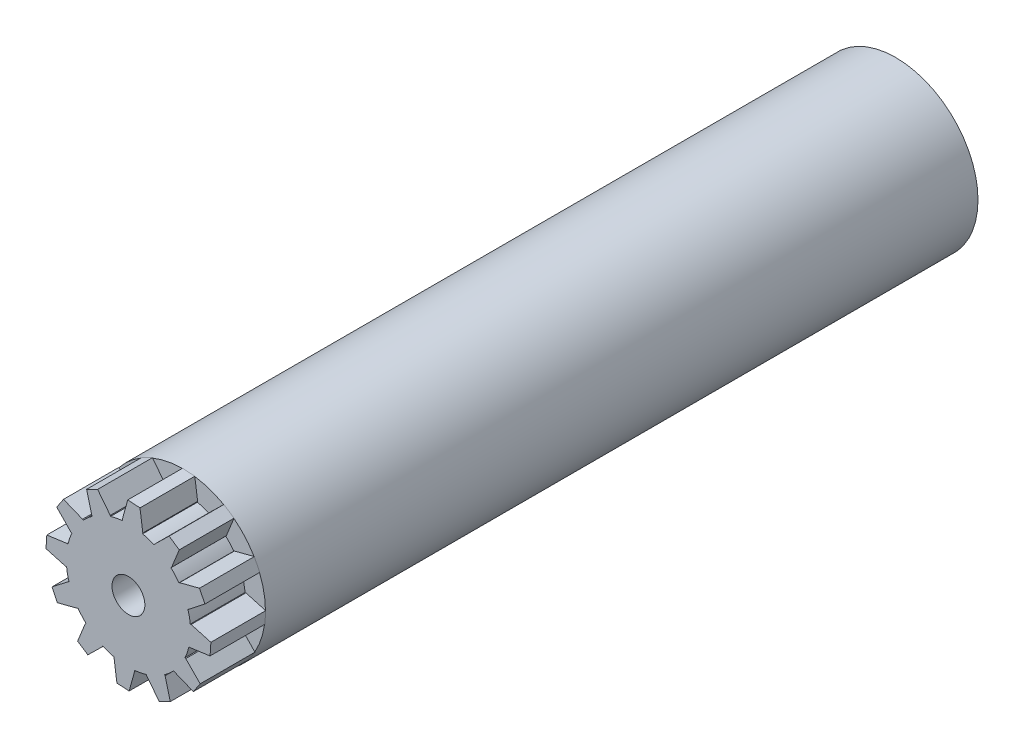
from build123d import *

# Parameters (mm, degrees)
SKETCH1_R           = 7.5
BOSS_EXTRUDE1_DEPTH = 65
BOSS_EXTRUDE7_DEPTH = 5
SKETCH5_R           = 1.5
CUT_EXTRUDE1_DEPTH  = 71.803359707


with BuildPart() as part:
    # Sketch1 → Boss-Extrude1 (new body)
    with BuildSketch(Plane.XY):
        Circle(SKETCH1_R)
    extrude(amount=BOSS_EXTRUDE1_DEPTH)

    # Sketch4 → Boss-Extrude7 (add)
    with BuildSketch(Plane.XY.offset(65)):
        with BuildLine():
            Line((1.29482372, 5.515672238), (1.312530063, 5.591097474))
            Line((1.312530063, 5.591097474), (1.052683226, 7.446710482))
            Line((1.052683226, 7.446710482), (-0.061368597, 7.52049685))
            Line((-0.061368597, 7.52049685), (-0.563675613, 5.715363149))
            Line((-0.563675613, 5.715363149), (-0.556071495, 5.63826154))
            ThreePointArc((-0.556071495, 5.63826154), (0.374427225, 5.653230311), (1.29482372, 5.515672238))
        make_face()
        with BuildLine():
            ThreePointArc((2.337558729, 5.160913474), (1.824832598, 5.363692263), (1.29482372, 5.515672238))
            Line((1.29482372, 5.515672238), (0, 0))
            Line((0, 0), (2.337558729, 5.160913474))
        make_face()
        with BuildLine():
            Line((0, 0), (1.29482372, 5.515672238))
            ThreePointArc((1.29482372, 5.515672238), (0.374427225, 5.653230311), (-0.556071495, 5.63826154))
            Line((-0.556071495, 5.63826154), (0, 0))
        make_face()
        with BuildLine():
            Line((-1.636485884, 5.424124137), (0, 0))
            Line((0, 0), (-0.556071495, 5.63826154))
            ThreePointArc((-0.556071495, 5.63826154), (-1.101494744, 5.557510057), (-1.636485884, 5.424124137))
        make_face()
        with BuildLine():
            Line((2.337558729, 5.160913474), (0, 0))
            Line((0, 0), (3.879186354, 4.129300417))
            ThreePointArc((3.879186354, 4.129300417), (3.150878645, 4.708627451), (2.337558729, 5.160913474))
        make_face()
        with BuildLine():
            Line((4.604841979, 3.300702811), (0, 0))
            Line((0, 0), (5.424124137, 1.636485884))
            ThreePointArc((5.424124137, 1.636485884), (5.083054676, 2.502351667), (4.604841979, 3.300702811))
        make_face()
        with BuildLine():
            Line((3.879186354, 4.129300417), (0, 0))
            Line((0, 0), (4.604841979, 3.300702811))
            ThreePointArc((4.604841979, 3.300702811), (4.262197519, 3.732677459), (3.879186354, 4.129300417))
        make_face()
        with BuildLine():
            Line((5.63826154, 0.556071495), (0, 0))
            Line((0, 0), (5.515672238, -1.29482372))
            ThreePointArc((5.515672238, -1.29482372), (5.628005488, -0.651738388), (5.665616357, 0))
            ThreePointArc((5.665616357, 0), (5.65877352, 0.27837196), (5.63826154, 0.556071495))
        make_face()
        with BuildLine():
            Line((5.424124137, 1.636485884), (0, 0))
            Line((0, 0), (5.63826154, 0.556071495))
            ThreePointArc((5.63826154, 0.556071495), (5.557510057, 1.101494744), (5.424124137, 1.636485884))
        make_face()
        with BuildLine():
            Line((5.160913474, -2.337558729), (0, 0))
            Line((0, 0), (4.129300417, -3.879186354))
            ThreePointArc((4.129300417, -3.879186354), (4.708627451, -3.150878645), (5.160913474, -2.337558729))
        make_face()
        with BuildLine():
            Line((5.515672238, -1.29482372), (0, 0))
            Line((0, 0), (5.160913474, -2.337558729))
            ThreePointArc((5.160913474, -2.337558729), (5.363692263, -1.824832598), (5.515672238, -1.29482372))
        make_face()
        with BuildLine():
            Line((3.300702811, -4.604841979), (0, 0))
            Line((0, 0), (1.636485884, -5.424124137))
            ThreePointArc((1.636485884, -5.424124137), (2.502351667, -5.083054676), (3.300702811, -4.604841979))
        make_face()
        with BuildLine():
            Line((4.129300417, -3.879186354), (0, 0))
            Line((0, 0), (3.300702811, -4.604841979))
            ThreePointArc((3.300702811, -4.604841979), (3.732677459, -4.262197519), (4.129300417, -3.879186354))
        make_face()
        with BuildLine():
            Line((0.556071495, -5.63826154), (0, 0))
            Line((0, 0), (-1.29482372, -5.515672238))
            ThreePointArc((-1.29482372, -5.515672238), (-0.374427225, -5.653230311), (0.556071495, -5.63826154))
        make_face()
        with BuildLine():
            Line((1.636485884, -5.424124137), (0, 0))
            Line((0, 0), (0.556071495, -5.63826154))
            ThreePointArc((0.556071495, -5.63826154), (1.101494744, -5.557510057), (1.636485884, -5.424124137))
        make_face()
        with BuildLine():
            Line((-2.337558729, -5.160913474), (0, 0))
            Line((0, 0), (-3.879186354, -4.129300417))
            ThreePointArc((-3.879186354, -4.129300417), (-3.150878645, -4.708627451), (-2.337558729, -5.160913474))
        make_face()
        with BuildLine():
            Line((-1.29482372, -5.515672238), (0, 0))
            Line((0, 0), (-2.337558729, -5.160913474))
            ThreePointArc((-2.337558729, -5.160913474), (-1.824832598, -5.363692263), (-1.29482372, -5.515672238))
        make_face()
        with BuildLine():
            Line((-4.604841979, -3.300702811), (0, 0))
            Line((0, 0), (-5.424124137, -1.636485884))
            ThreePointArc((-5.424124137, -1.636485884), (-5.083054676, -2.502351667), (-4.604841979, -3.300702811))
        make_face()
        with BuildLine():
            Line((-3.879186354, -4.129300417), (0, 0))
            Line((0, 0), (-4.604841979, -3.300702811))
            ThreePointArc((-4.604841979, -3.300702811), (-4.262197519, -3.732677459), (-3.879186354, -4.129300417))
        make_face()
        with BuildLine():
            Line((-5.63826154, -0.556071495), (0, 0))
            Line((0, 0), (-5.515672238, 1.29482372))
            ThreePointArc((-5.515672238, 1.29482372), (-5.653230311, 0.374427225), (-5.63826154, -0.556071495))
        make_face()
        with BuildLine():
            Line((-5.424124137, -1.636485884), (0, 0))
            Line((0, 0), (-5.63826154, -0.556071495))
            ThreePointArc((-5.63826154, -0.556071495), (-5.557510057, -1.101494744), (-5.424124137, -1.636485884))
        make_face()
        with BuildLine():
            Line((-5.160913474, 2.337558729), (0, 0))
            Line((0, 0), (-4.129300417, 3.879186354))
            ThreePointArc((-4.129300417, 3.879186354), (-4.708627451, 3.150878645), (-5.160913474, 2.337558729))
        make_face()
        with BuildLine():
            Line((-5.515672238, 1.29482372), (0, 0))
            Line((0, 0), (-5.160913474, 2.337558729))
            ThreePointArc((-5.160913474, 2.337558729), (-5.363692263, 1.824832598), (-5.515672238, 1.29482372))
        make_face()
        with BuildLine():
            Line((-3.300702811, 4.604841979), (0, 0))
            Line((0, 0), (-1.636485884, 5.424124137))
            ThreePointArc((-1.636485884, 5.424124137), (-2.502351667, 5.083054676), (-3.300702811, 4.604841979))
        make_face()
        with BuildLine():
            Line((-4.129300417, 3.879186354), (0, 0))
            Line((0, 0), (-3.300702811, 4.604841979))
            ThreePointArc((-3.300702811, 4.604841979), (-3.732677459, 4.262197519), (-4.129300417, 3.879186354))
        make_face()
        with BuildLine():
            Line((2.369524174, 5.231487486), (2.337558729, 5.160913474))
            ThreePointArc((2.337558729, 5.160913474), (3.150878645, 4.708627451), (3.879186354, 4.129300417))
            Line((3.879186354, 4.129300417), (3.932233115, 4.185767416))
            Line((3.932233115, 4.185767416), (4.635005657, 5.922698839))
            Line((4.635005657, 5.922698839), (3.707101661, 6.54362562))
            Line((3.707101661, 6.54362562), (2.369524174, 5.231487486))
        make_face()
        with BuildLine():
            ThreePointArc((4.604841979, 3.300702811), (5.083054676, 2.502351667), (5.424124137, 1.636485884))
            Line((5.424124137, 1.636485884), (5.498297479, 1.658864359))
            Line((5.498297479, 1.658864359), (6.975382065, 2.811704825))
            Line((6.975382065, 2.811704825), (6.482257022, 3.813395189))
            Line((6.482257022, 3.813395189), (4.667811873, 3.345838975))
            Line((4.667811873, 3.345838975), (4.604841979, 3.300702811))
        make_face()
        with BuildLine():
            ThreePointArc((5.665616357, 0), (5.628005488, -0.651738388), (5.515672238, -1.29482372))
            Line((5.515672238, -1.29482372), (5.591097474, -1.312530063))
            Line((5.591097474, -1.312530063), (7.446710482, -1.052683226))
            Line((7.446710482, -1.052683226), (7.52049685, 0.061368597))
            Line((7.52049685, 0.061368597), (5.715363149, 0.563675613))
            Line((5.715363149, 0.563675613), (5.63826154, 0.556071495))
            ThreePointArc((5.63826154, 0.556071495), (5.65877352, 0.27837196), (5.665616357, 0))
        make_face()
        with BuildLine():
            ThreePointArc((5.160913474, -2.337558729), (4.708627451, -3.150878645), (4.129300417, -3.879186354))
            Line((4.129300417, -3.879186354), (4.185767416, -3.932233115))
            Line((4.185767416, -3.932233115), (5.922698839, -4.635005657))
            Line((5.922698839, -4.635005657), (6.54362562, -3.707101661))
            Line((6.54362562, -3.707101661), (5.231487486, -2.369524174))
            Line((5.231487486, -2.369524174), (5.160913474, -2.337558729))
        make_face()
        with BuildLine():
            ThreePointArc((3.300702811, -4.604841979), (2.502351667, -5.083054676), (1.636485884, -5.424124137))
            Line((1.636485884, -5.424124137), (1.658864359, -5.498297479))
            Line((1.658864359, -5.498297479), (2.811704825, -6.975382065))
            Line((2.811704825, -6.975382065), (3.813395189, -6.482257022))
            Line((3.813395189, -6.482257022), (3.345838975, -4.667811873))
            Line((3.345838975, -4.667811873), (3.300702811, -4.604841979))
        make_face()
        with BuildLine():
            ThreePointArc((0.556071495, -5.63826154), (-0.374427225, -5.653230311), (-1.29482372, -5.515672238))
            Line((-1.29482372, -5.515672238), (-1.312530063, -5.591097474))
            Line((-1.312530063, -5.591097474), (-1.052683226, -7.446710482))
            Line((-1.052683226, -7.446710482), (0.061368597, -7.52049685))
            Line((0.061368597, -7.52049685), (0.563675613, -5.715363149))
            Line((0.563675613, -5.715363149), (0.556071495, -5.63826154))
        make_face()
        with BuildLine():
            ThreePointArc((-2.337558729, -5.160913474), (-3.150878645, -4.708627451), (-3.879186354, -4.129300417))
            Line((-3.879186354, -4.129300417), (-3.932233115, -4.185767416))
            Line((-3.932233115, -4.185767416), (-4.635005657, -5.922698839))
            Line((-4.635005657, -5.922698839), (-3.707101661, -6.54362562))
            Line((-3.707101661, -6.54362562), (-2.369524174, -5.231487486))
            Line((-2.369524174, -5.231487486), (-2.337558729, -5.160913474))
        make_face()
        with BuildLine():
            ThreePointArc((-4.604841979, -3.300702811), (-5.083054676, -2.502351667), (-5.424124137, -1.636485884))
            Line((-5.424124137, -1.636485884), (-5.498297479, -1.658864359))
            Line((-5.498297479, -1.658864359), (-6.975382065, -2.811704825))
            Line((-6.975382065, -2.811704825), (-6.482257022, -3.813395189))
            Line((-6.482257022, -3.813395189), (-4.667811873, -3.345838975))
            Line((-4.667811873, -3.345838975), (-4.604841979, -3.300702811))
        make_face()
        with BuildLine():
            ThreePointArc((-5.63826154, -0.556071495), (-5.653230311, 0.374427225), (-5.515672238, 1.29482372))
            Line((-5.515672238, 1.29482372), (-5.591097474, 1.312530063))
            Line((-5.591097474, 1.312530063), (-7.446710482, 1.052683226))
            Line((-7.446710482, 1.052683226), (-7.52049685, -0.061368597))
            Line((-7.52049685, -0.061368597), (-5.715363149, -0.563675613))
            Line((-5.715363149, -0.563675613), (-5.63826154, -0.556071495))
        make_face()
        with BuildLine():
            ThreePointArc((-5.160913474, 2.337558729), (-4.708627451, 3.150878645), (-4.129300417, 3.879186354))
            Line((-4.129300417, 3.879186354), (-4.185767416, 3.932233115))
            Line((-4.185767416, 3.932233115), (-5.922698839, 4.635005657))
            Line((-5.922698839, 4.635005657), (-6.54362562, 3.707101661))
            Line((-6.54362562, 3.707101661), (-5.231487486, 2.369524174))
            Line((-5.231487486, 2.369524174), (-5.160913474, 2.337558729))
        make_face()
        with BuildLine():
            ThreePointArc((-3.300702811, 4.604841979), (-2.502351667, 5.083054676), (-1.636485884, 5.424124137))
            Line((-1.636485884, 5.424124137), (-1.658864359, 5.498297479))
            Line((-1.658864359, 5.498297479), (-2.811704825, 6.975382065))
            Line((-2.811704825, 6.975382065), (-3.813395189, 6.482257022))
            Line((-3.813395189, 6.482257022), (-3.345838975, 4.667811873))
            Line((-3.345838975, 4.667811873), (-3.300702811, 4.604841979))
        make_face()
    extrude(amount=BOSS_EXTRUDE7_DEPTH)

    # Sketch5 → Cut-Extrude1 (cut, through all)
    with BuildSketch(Plane(origin=(0, 0, 0), x_dir=(-1, 0, 0), z_dir=(0, 0, -1))):
        Circle(SKETCH5_R)
    extrude(amount=-CUT_EXTRUDE1_DEPTH, mode=Mode.SUBTRACT)


solid = part.part
